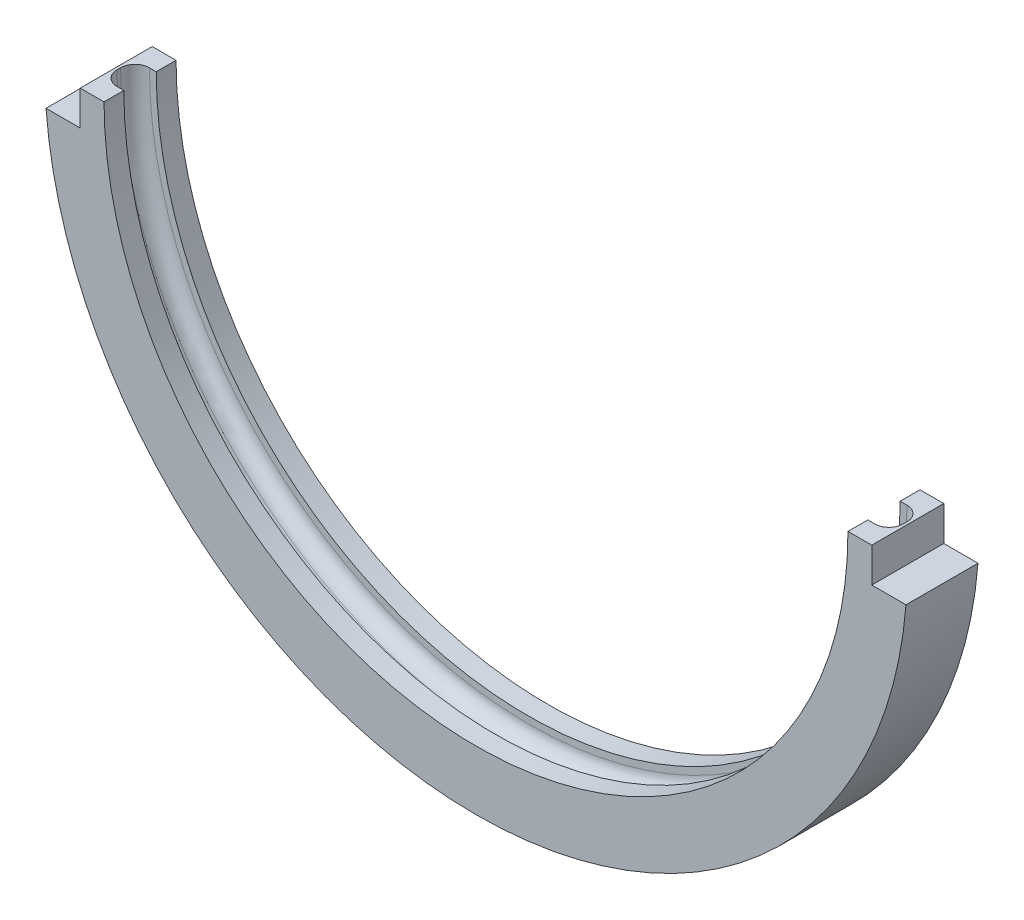
from build123d import *

# Parameters (mm, degrees)
BOSS_EXTRUDE1_DEPTH = 5.715
BOSS_EXTRUDE2_DEPTH = 3.4925
BOSS_EXTRUDE3_START = 3.4925
BOSS_EXTRUDE3_DEPTH = 3.4925
FILLET1_R           = 2.54
SKETCH5_R           = 1.524
CUT_EXTRUDE1_DEPTH  = 6.35
SKETCH6_W           = 6.0325
SKETCH6_H           = 6.096
CUT_EXTRUDE2_DEPTH  = 109.330479049
SKETCH7_W           = 13.176307298
SKETCH7_H           = 9.310122243
CUT_EXTRUDE3_DEPTH  = 109.330478908


with BuildPart() as part:
    # Sketch1 → Boss-Extrude1 (new body)
    with BuildSketch(Plane.XY):
        with BuildLine():
            ThreePointArc((69.342, 76.073), (0, 6.731), (-69.342, 76.073))
            Line((-69.342, 76.073), (-76.073, 76.073))
            ThreePointArc((-76.073, 76.073), (0, 0), (76.073, 76.073))
            Line((76.073, 76.073), (69.342, 76.073))
        make_face()
    extrude(amount=BOSS_EXTRUDE1_DEPTH)

    # Sketch3 → Boss-Extrude2 (add)
    with BuildSketch(Plane.XY.offset(5.715)):
        with BuildLine():
            ThreePointArc((65.5955, 76.073), (0, 10.4775), (-65.5955, 76.073))
            Line((-65.5955, 76.073), (-76.073, 76.073))
            ThreePointArc((-76.073, 76.073), (0, 0), (76.073, 76.073))
            Line((76.073, 76.073), (65.5955, 76.073))
        make_face()
    extrude(amount=BOSS_EXTRUDE2_DEPTH)

    # Sketch4 → Boss-Extrude3 (add)
    with BuildSketch(Plane(origin=(0, 0, 0), x_dir=(-1, 0, 0), z_dir=(0, 0, -1)).offset(BOSS_EXTRUDE3_START)):
        with BuildLine():
            ThreePointArc((65.5955, 76.073), (0, 10.4775), (-65.5955, 76.073))
            Line((-65.5955, 76.073), (-76.073, 76.073))
            ThreePointArc((-76.073, 76.073), (0, 0), (76.073, 76.073))
            Line((76.073, 76.073), (65.5955, 76.073))
        make_face()
    extrude(amount=-BOSS_EXTRUDE3_DEPTH)

    # Fillet1
    fillet1_edges = [part.edges().sort_by_distance(p)[0] for p in [
        (0, 6.731, 5.715),
        (0, 6.731, 0),
    ]]
    fillet(fillet1_edges, radius=FILLET1_R)

    # Sketch5 → Cut-Extrude1 (cut)
    with BuildSketch(Plane(origin=(0, 0, 0), x_dir=(1, 0, 0), z_dir=(0, 1, 0))):
        with Locations((0, -2.8575)):
            Circle(SKETCH5_R)
    extrude(amount=CUT_EXTRUDE1_DEPTH, mode=Mode.SUBTRACT)

    # Sketch6 → Cut-Extrude2 (cut, through all)
    with BuildSketch(Plane.XY.offset(9.2075)):
        with BuildLine():
            Line((-82.07762594, 69.977), (-75.828359556, 69.977))
            ThreePointArc((-75.828359556, 69.977), (-76.011815284, 73.022546552), (-76.073, 76.073))
            Line((-76.073, 76.073), (-82.07762594, 76.073))
            Line((-82.07762594, 76.073), (-82.07762594, 69.977))
        make_face()
        with Locations((-72.812109556, 73.025)):
            Rectangle(SKETCH6_W, SKETCH6_H)
        with Locations((72.812109556, 73.025)):
            Rectangle(SKETCH6_W, SKETCH6_H)
        with BuildLine():
            ThreePointArc((76.073, 76.073), (76.011815284, 73.022546552), (75.828359556, 69.977))
            Line((75.828359556, 69.977), (82.07762594, 69.977))
            Line((82.07762594, 69.977), (82.07762594, 76.073))
            Line((82.07762594, 76.073), (76.073, 76.073))
        make_face()
    extrude(amount=-CUT_EXTRUDE2_DEPTH, mode=Mode.SUBTRACT)


with BuildPart() as cut_extrude2_piece_1:
    # of the separate pieces the step leaves, piece 1, a body of its own (cut_extrude2_pieces)
    add(part.part.solids().sort_by_distance((66.802, 76.073, 5.715))[0])


with BuildPart() as cut_extrude2_piece_2:
    # of the separate pieces the step leaves, piece 2, a body of its own (cut_extrude2_pieces)
    add(part.part.solids().sort_by_distance((76.073, 76.073, 9.2075))[0])


with BuildPart() as cut_extrude2_piece_3:
    # of the separate pieces the step leaves, piece 3, a body of its own (cut_extrude2_pieces)
    add(part.part.solids().sort_by_distance((-76.073, 76.073, 9.2075))[0])


with BuildPart() as cut_extrude3_tool:
    # Sketch7 → Cut-Extrude3 (new, through all)
    with BuildSketch(Plane.XY.offset(9.2075)):
        with Locations((-79.400263205, 74.632061122)):
            Rectangle(SKETCH7_W, SKETCH7_H)
        with Locations((79.400263205, 74.632061122)):
            Rectangle(SKETCH7_W, SKETCH7_H)
    extrude(amount=-CUT_EXTRUDE3_DEPTH)


with BuildPart() as cut_extrude2_piece_2_1:
    add(cut_extrude2_piece_2.part)

    # Cut-Extrude3: cut by cut_extrude3_tool
    add(cut_extrude3_tool.part, mode=Mode.SUBTRACT)


with BuildPart() as cut_extrude2_piece_3_1:
    add(cut_extrude2_piece_3.part)

    # Cut-Extrude3: cut by cut_extrude3_tool
    add(cut_extrude3_tool.part, mode=Mode.SUBTRACT)


solid = cut_extrude2_piece_1.part
